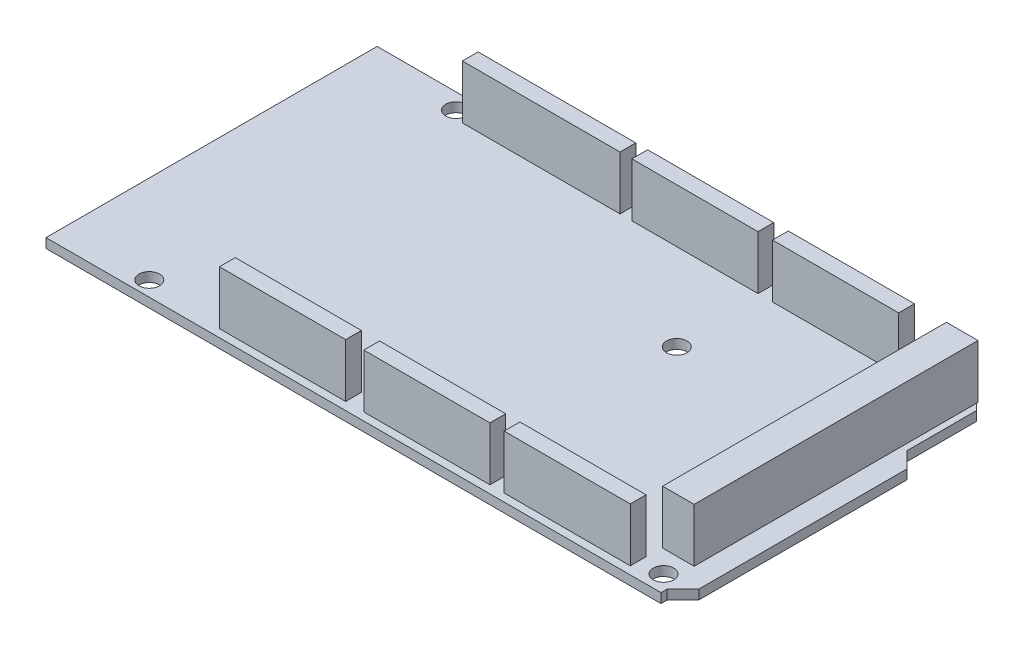
from build123d import *

# Parameters (mm, degrees)
BOSS_EXTRUDE1_DEPTH        = 0.762
F_1_3_1_3_DIAMETER_HOLE1_D = 1.3
F_3_3_3_3_DIAMETER_HOLE1_D = 3.3
SKETCH6_W                  = 25.4
SKETCH6_H                  = 2.54
BOSS_EXTRUDE2_DEPTH        = 8.636
SKETCH6_W_2                = 20.32
BOSS_EXTRUDE2_2_DEPTH      = 8.636
BOSS_EXTRUDE2_3_DEPTH      = 8.636
SKETCH6_W_3                = 5.08
SKETCH6_H_2                = 45.72
BOSS_EXTRUDE2_4_DEPTH      = 8.636
BOSS_EXTRUDE2_5_DEPTH      = 8.636
BOSS_EXTRUDE2_6_DEPTH      = 8.636
BOSS_EXTRUDE2_7_DEPTH      = 8.636


with BuildPart() as part:
    # Sketch1 → Boss-Extrude1 (new, symmetric)
    with BuildSketch(Plane(origin=(0, 0, 0), x_dir=(1, 0, 0), z_dir=(0, 1, 0))):
        Polygon((99.06, 39.608), (101.6, 37.068), (101.6, 3.54), (99.06, 1), (99.06, 0), (0, 0), (0, 53.34), (96.52, 53.34), (99.06, 50.8), align=None)
    extrude(amount=BOSS_EXTRUDE1_DEPTH, both=True)

    # Ø1.3 (1.3) Diameter Hole1 (through all)
    with Locations(Plane(origin=(0, 0.762, 0), x_dir=(1, 0, 0), z_dir=(0, 1, 0))):
        with Locations((27.94, 2.54), (18.796, 50.8), (30.48, 2.54), (33.02, 2.54), (35.56, 2.54), (38.1, 2.54), (40.64, 2.54), (43.18, 2.54), (45.72, 2.54), (21.336, 50.8), (23.876, 50.8), (26.416, 50.8), (28.956, 50.8), (31.496, 50.8), (34.036, 50.8), (36.576, 50.8), (39.116, 50.8), (41.656, 50.8), (51.181, 2.54), (46.101, 50.8), (53.721, 2.54), (56.261, 2.54), (58.801, 2.54), (61.341, 2.54), (63.881, 2.54), (66.421, 2.54), (68.961, 2.54), (48.641, 50.8), (51.181, 50.8), (53.721, 50.8), (56.261, 50.8), (58.801, 50.8), (61.341, 50.8), (63.881, 50.8), (68.7578, 50.8), (73.787, 2.54), (71.2978, 50.8), (76.327, 2.54), (73.8378, 50.8), (78.867, 2.54), (76.3778, 50.8), (81.407, 2.54), (78.9178, 50.8), (83.947, 2.54), (81.4578, 50.8), (86.487, 2.54), (83.9978, 50.8), (89.027, 2.54), (86.5378, 50.8), (91.567, 2.54), (94.234, 50.8), (96.774, 50.8), (94.234, 48.26), (96.774, 48.26), (94.234, 45.72), (96.774, 45.72), (94.234, 43.18), (96.774, 43.18), (94.234, 40.64), (96.774, 40.64), (94.234, 38.1), (96.774, 38.1), (94.234, 35.56), (96.774, 35.56), (94.234, 33.02), (96.774, 33.02), (94.234, 30.48), (96.774, 30.48), (94.234, 27.94), (96.774, 27.94), (94.234, 25.4), (96.774, 25.4), (94.234, 22.86), (96.774, 22.86), (94.234, 20.32), (96.774, 20.32), (94.234, 17.78), (96.774, 17.78), (94.234, 15.24), (96.774, 15.24), (94.234, 12.7), (96.774, 12.7), (94.234, 10.16), (96.774, 10.16), (94.234, 7.62), (96.774, 7.62)):
            Hole(F_1_3_1_3_DIAMETER_HOLE1_D / 2)

    # Ø3.3 (3.3) Diameter Hole1 (through all)
    with Locations(Plane(origin=(0, 0.762, 0), x_dir=(1, 0, 0), z_dir=(0, 1, 0))):
        with Locations((15.24, 50.8), (90.3732, 50.8), (96.647, 2.809446088), (66.04, 7.366), (66.04, 35.56), (14.224, 2.413)):
            Hole(F_3_3_3_3_DIAMETER_HOLE1_D / 2)


with BuildPart() as body_2:
    # Sketch6 → Boss-Extrude2 (new body)
    with BuildSketch(Plane(origin=(0, 0.762, 0), x_dir=(1, 0, 0), z_dir=(0, 1, 0))):
        with Locations((30.226, 50.8)):
            Rectangle(SKETCH6_W, SKETCH6_H)
    extrude(amount=BOSS_EXTRUDE2_DEPTH)


with BuildPart() as body_3:
    # Sketch6 → Boss-Extrude2 2 (new body)
    with BuildSketch(Plane(origin=(0, 0.762, 0), x_dir=(1, 0, 0), z_dir=(0, 1, 0))):
        with Locations((54.991, 50.8)):
            Rectangle(SKETCH6_W_2, SKETCH6_H)
    extrude(amount=BOSS_EXTRUDE2_2_DEPTH)


with BuildPart() as body_4:
    # Sketch6 → Boss-Extrude2 3 (new body)
    with BuildSketch(Plane(origin=(0, 0.762, 0), x_dir=(1, 0, 0), z_dir=(0, 1, 0))):
        with Locations((77.6478, 50.8)):
            Rectangle(SKETCH6_W_2, SKETCH6_H)
    extrude(amount=BOSS_EXTRUDE2_3_DEPTH)


with BuildPart() as body_5:
    # Sketch6 → Boss-Extrude2 4 (new body)
    with BuildSketch(Plane(origin=(0, 0.762, 0), x_dir=(1, 0, 0), z_dir=(0, 1, 0))):
        with Locations((95.504, 29.21)):
            Rectangle(SKETCH6_W_3, SKETCH6_H_2)
    extrude(amount=BOSS_EXTRUDE2_4_DEPTH)


with BuildPart() as body_6:
    # Sketch6 → Boss-Extrude2 5 (new body)
    with BuildSketch(Plane(origin=(0, 0.762, 0), x_dir=(1, 0, 0), z_dir=(0, 1, 0))):
        with Locations((82.677, 2.54)):
            Rectangle(SKETCH6_W_2, SKETCH6_H)
    extrude(amount=BOSS_EXTRUDE2_5_DEPTH)


with BuildPart() as body_7:
    # Sketch6 → Boss-Extrude2 6 (new body)
    with BuildSketch(Plane(origin=(0, 0.762, 0), x_dir=(1, 0, 0), z_dir=(0, 1, 0))):
        with Locations((36.83, 2.54)):
            Rectangle(SKETCH6_W_2, SKETCH6_H)
    extrude(amount=BOSS_EXTRUDE2_6_DEPTH)


with BuildPart() as body_8:
    # Sketch6 → Boss-Extrude2 7 (new body)
    with BuildSketch(Plane(origin=(0, 0.762, 0), x_dir=(1, 0, 0), z_dir=(0, 1, 0))):
        with Locations((60.071, 2.54)):
            Rectangle(SKETCH6_W_2, SKETCH6_H)
    extrude(amount=BOSS_EXTRUDE2_7_DEPTH)


solid = Compound([part.part, body_2.part, body_3.part, body_4.part, body_5.part, body_6.part, body_7.part, body_8.part])
